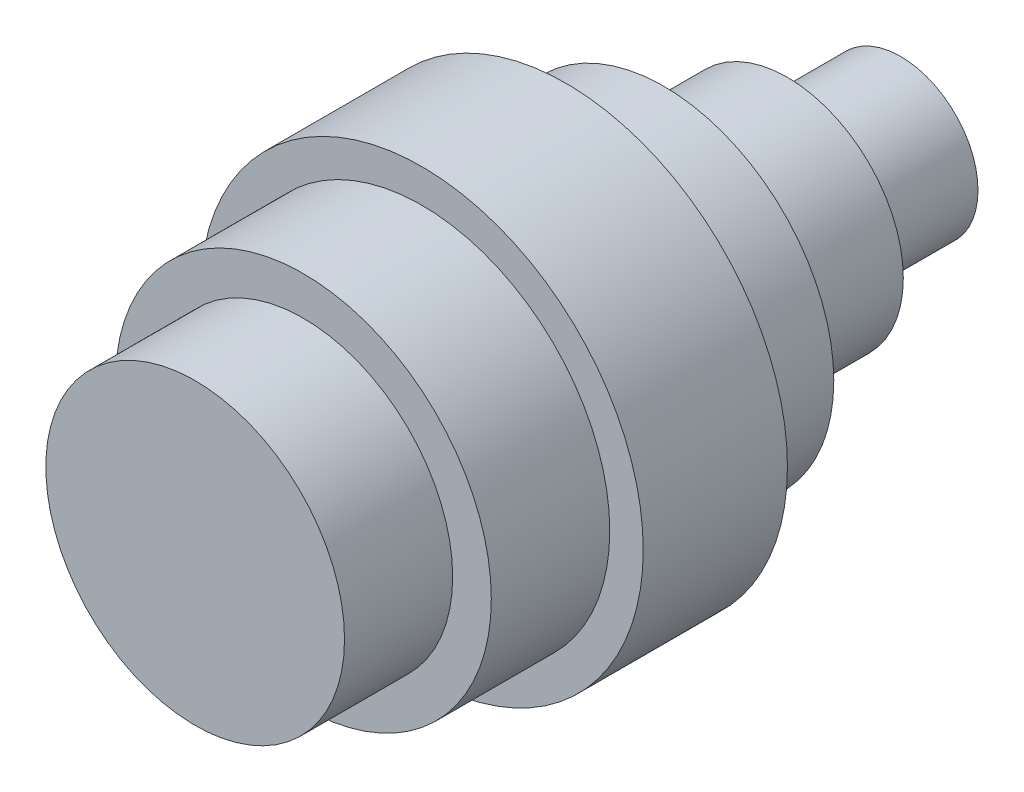
from build123d import *

# Parameters (mm, degrees)
SKETCH1_W   = 10.5
SKETCH1_H   = 14.5
SKETCH1_W_2 = 11
SKETCH1_H_2 = 7.5


with BuildPart() as part:
    # Sketch1 → Revolve1 (revolve)
    with BuildSketch(Plane(origin=(0, 0, 0), x_dir=(0, 0, -1), z_dir=(1, 0, 0)), mode=Mode.PRIVATE) as revolve1_sk:
        with Locations((5.25, 7.25)):
            Rectangle(SKETCH1_W, SKETCH1_H)
        Polygon((10.5, 14.5), (10.5, 0), (22, 0), (22, 18.25), (10.5, 18.25), align=None)
        Polygon((22, 18.25), (22, 0), (36, 0), (36, 16.5), (36, 21.5), (22, 21.5), align=None)
        Polygon((36, 16.5), (36, 0), (45.5, 0), (45.5, 11.25), (45.5, 16.5), align=None)
        Polygon((45.5, 11.25), (45.5, 0), (57.5, 0), (57.5, 7.5), (57.5, 11.25), align=None)
        with Locations((63, 3.75)):
            Rectangle(SKETCH1_W_2, SKETCH1_H_2)
    revolve(revolve1_sk.sketch.rotate(Axis((0, 0, -22), (0, 0, -1)), 90), axis=Axis((0, 0, -22), (0, 0, -1)))


solid = part.part
